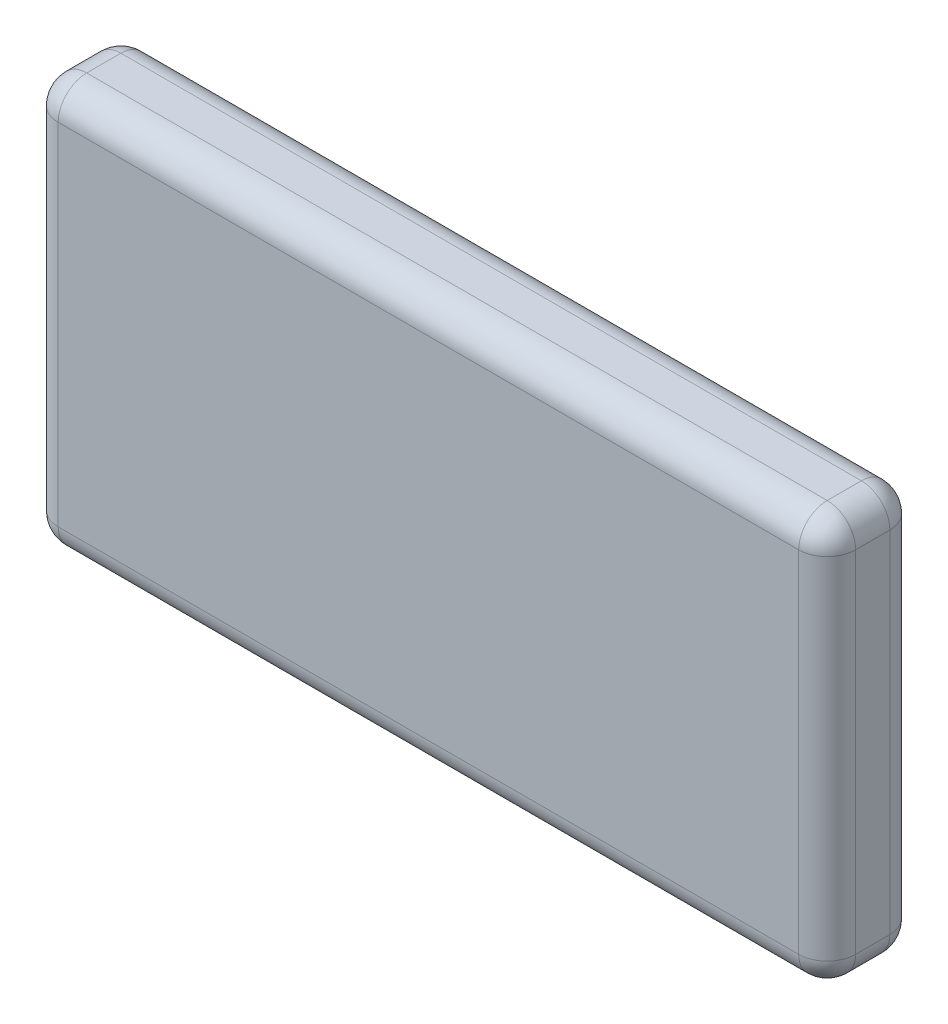
from build123d import *

# Parameters (mm, degrees)
SKETCH1_W           = 140
SKETCH1_H           = 71.5
BOSS_EXTRUDE1_DEPTH = 16
FILLET1_R           = 5


with BuildPart() as part:
    # Sketch1 → Boss-Extrude1 (new body)
    with BuildSketch(Plane.XY):
        Rectangle(SKETCH1_W, SKETCH1_H)
    extrude(amount=BOSS_EXTRUDE1_DEPTH)

    # Fillet1
    fillet1_edges = [part.edges().sort_by_distance(p)[0] for p in [
        (-70, 0, 16),
        (0, -35.75, 16),
        (70, 0, 16),
        (0, -35.75, 0),
        (-70, 0, 0),
        (0, 35.75, 0),
        (70, 0, 0),
        (70, -35.75, 8),
        (-70, -35.75, 8),
        (-70, 35.75, 8),
        (70, 35.75, 8),
        (0, 35.75, 16),
    ]]
    fillet(fillet1_edges, radius=FILLET1_R)


solid = part.part
